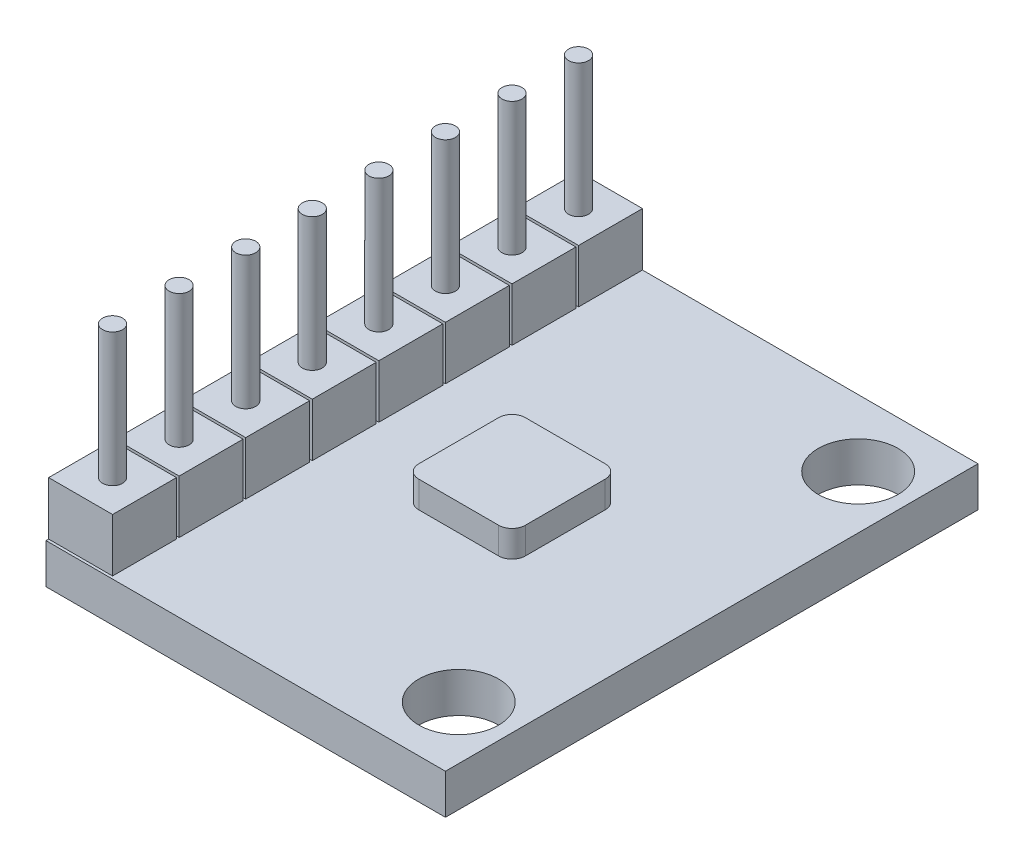
from build123d import *

# Parameters (mm, degrees)
SKETCH1_W           = 15
SKETCH1_H           = 20
BOSS_EXTRUDE1_DEPTH = 1.5
SKETCH2_R           = 1.5
CUT_EXTRUDE1_DEPTH  = 13.589678312
SKETCH3_W           = 4
SKETCH3_H           = 4
BOSS_EXTRUDE2_DEPTH = 1
FILLET2_R           = 0.5
SKETCH4_W           = 2.4
SKETCH4_H           = 2.4
BOSS_EXTRUDE3_DEPTH = 2
SKETCH5_R           = 0.375
BOSS_EXTRUDE4_DEPTH = 5


with BuildPart() as part:
    # Sketch1 → Boss-Extrude1 (new body)
    with BuildSketch(Plane(origin=(0, 0, 0), x_dir=(1, 0, 0), z_dir=(0, 1, 0))):
        Rectangle(SKETCH1_W, SKETCH1_H)
    extrude(amount=BOSS_EXTRUDE1_DEPTH)

    # Sketch2 → Cut-Extrude1 (cut, through all)
    with BuildSketch(Plane(origin=(0, 1.5, 0), x_dir=(1, 0, 0), z_dir=(0, 1, 0))):
        with Locations(Location((5.5, -7.5, 0), (0, 0, 270))):
            Circle(SKETCH2_R)
        with Locations(Location((5.5, 7.5, 0), (0, 0, 90))):
            Circle(SKETCH2_R)
    extrude(amount=-CUT_EXTRUDE1_DEPTH, mode=Mode.SUBTRACT)

    # Sketch3 → Boss-Extrude2 (add)
    with BuildSketch(Plane(origin=(0, 1.5, 0), x_dir=(1, 0, 0), z_dir=(0, 1, 0))):
        Rectangle(SKETCH3_W, SKETCH3_H)
    extrude(amount=BOSS_EXTRUDE2_DEPTH)

    # Fillet2
    fillet2_edges = [part.edges().sort_by_distance(p)[0] for p in [
        (-2, 2, -2),
        (-2, 2, 2),
        (2, 2, 2),
        (2, 2, -2),
    ]]
    fillet(fillet2_edges, radius=FILLET2_R)

    # Sketch4 → Boss-Extrude3 (add)
    with BuildSketch(Plane(origin=(0, 1.5, 0), x_dir=(1, 0, 0), z_dir=(0, 1, 0))):
        with Locations((-6.3, 8.8)):
            Rectangle(SKETCH4_W, SKETCH4_H)
        with Locations((-6.3, 6.3)):
            Rectangle(SKETCH4_W, SKETCH4_H)
        with Locations((-6.3, 3.8)):
            Rectangle(SKETCH4_W, SKETCH4_H)
        with Locations((-6.3, 1.3)):
            Rectangle(SKETCH4_W, SKETCH4_H)
        with Locations((-6.3, -1.2)):
            Rectangle(SKETCH4_W, SKETCH4_H)
        with Locations((-6.3, -3.7)):
            Rectangle(SKETCH4_W, SKETCH4_H)
        with Locations((-6.3, -6.2)):
            Rectangle(SKETCH4_W, SKETCH4_H)
        with Locations((-6.3, -8.7)):
            Rectangle(SKETCH4_W, SKETCH4_H)
    extrude(amount=BOSS_EXTRUDE3_DEPTH)

    # Sketch5 → Boss-Extrude4 (add)
    with BuildSketch(Plane(origin=(0, 3.5, 0), x_dir=(1, 0, 0), z_dir=(0, 1, 0))):
        with Locations(Location((-6.3, 8.8, 0), (0, 0, 270))):
            Circle(SKETCH5_R)
        with Locations(Location((-6.3, 6.3, 0), (0, 0, 90))):
            Circle(SKETCH5_R)
        with Locations(Location((-6.3, 3.8, 0), (0, 0, 90))):
            Circle(SKETCH5_R)
        with Locations(Location((-6.3, 1.3, 0), (0, 0, 90))):
            Circle(SKETCH5_R)
        with Locations(Location((-6.3, -1.2, 0), (0, 0, 90))):
            Circle(SKETCH5_R)
        with Locations(Location((-6.3, -3.7, 0), (0, 0, 90))):
            Circle(SKETCH5_R)
        with Locations(Location((-6.3, -6.2, 0), (0, 0, 90))):
            Circle(SKETCH5_R)
        with Locations(Location((-6.3, -8.7, 0), (0, 0, 90))):
            Circle(SKETCH5_R)
    extrude(amount=BOSS_EXTRUDE4_DEPTH)


solid = part.part
